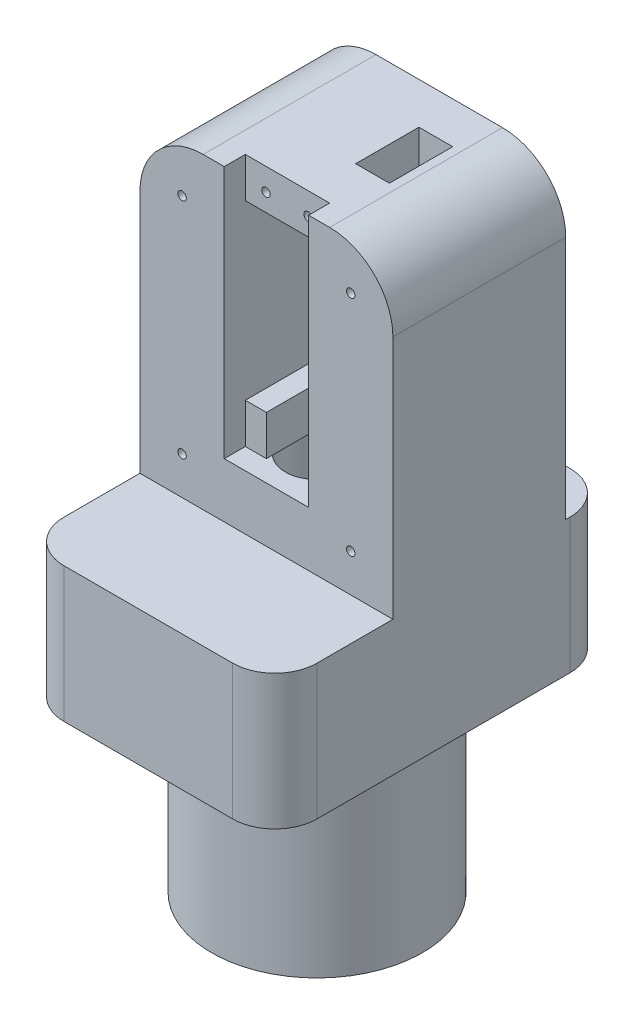
from build123d import *

# Parameters (mm, degrees)
SKETCH1_R                = 25
BOSS_EXTRUDE1_DEPTH      = 45
SKETCH2_W                = 60
SKETCH2_H                = 80
BOSS_EXTRUDE2_DEPTH      = 45
FILLET1_R                = 10
SKETCH3_W                = 60
SKETCH3_H                = 41
BOSS_EXTRUDE3_DEPTH      = 60
SKETCH4_W                = 20
SKETCH4_H                = 41
CUT_EXTRUDE1_DEPTH       = 32
SKETCH5_W                = 20
SKETCH5_H                = 9.5
CUT_EXTRUDE2_DEPTH       = 5
SKETCH7_R                = 15
CUT_EXTRUDE3_DEPTH       = 8
CUT_EXTRUDE4_REACH       = 163.567
SKETCH8_R                = 21
FILLET2_R                = 15
CUT_EXTRUDE5_REACH       = 169.812
SKETCH9_W                = 65
SKETCH9_H                = 65
CUT_EXTRUDE6_REACH       = 163.567
SKETCH10_W               = 65
SKETCH10_H               = 65
SKETCH11_R               = 1
CUT_EXTRUDE7_DEPTH       = 10
SKETCH12_R               = 1
CUT_EXTRUDE8_DEPTH       = 10
CUT_EXTRUDE9_START       = -27
SKETCH13_W               = 10
SKETCH13_H               = 9.5
CUT_EXTRUDE9_DEPTH       = 27
CUT_EXTRUDE10_DEPTH      = 5
CUT_EXTRUDE10_DEPTH_BACK = 3
SKETCH14_W               = 15
SKETCH14_H               = 62.680052408
SKETCH15_R               = 7.5
CUT_EXTRUDE11_DEPTH      = 90
SKETCH16_W               = 24
SKETCH16_H               = 24
CUT_EXTRUDE12_DEPTH      = 10
FILLET3_R                = 3


with BuildPart() as part:
    # Sketch1 → Boss-Extrude1 (new body)
    with BuildSketch(Plane(origin=(0, 0, 0), x_dir=(1, 0, 0), z_dir=(0, 1, 0))):
        with Locations(Location((0, 0, 0), (0, 0, 90))):
            Circle(SKETCH1_R)
    extrude(amount=BOSS_EXTRUDE1_DEPTH)

    # Sketch2 → Boss-Extrude2 (add)
    with BuildSketch(Plane(origin=(0, 45, 0), x_dir=(1, 0, 0), z_dir=(0, 1, 0))):
        Rectangle(SKETCH2_W, SKETCH2_H)
    extrude(amount=BOSS_EXTRUDE2_DEPTH)

    # Fillet1
    fillet1_edges = [part.edges().sort_by_distance(p)[0] for p in [
        (-30, 67.5, -40),
        (-30, 67.5, 40),
        (30, 67.5, 40),
        (30, 67.5, -40),
    ]]
    fillet(fillet1_edges, radius=FILLET1_R)

    # Sketch3 → Boss-Extrude3 (add)
    with BuildSketch(Plane(origin=(0, 90, 0), x_dir=(1, 0, 0), z_dir=(0, 1, 0))):
        with Locations((0, 8.5)):
            Rectangle(SKETCH3_W, SKETCH3_H)
    extrude(amount=BOSS_EXTRUDE3_DEPTH)

    # Sketch4 → Cut-Extrude1 (cut)
    with BuildSketch(Plane.XY.offset(12)):
        with Locations((0, 120)):
            Rectangle(SKETCH4_W, SKETCH4_H)
    extrude(amount=-CUT_EXTRUDE1_DEPTH, mode=Mode.SUBTRACT)

    # Sketch5 → Cut-Extrude2 (cut)
    with BuildSketch(Plane.XY.offset(12)):
        with Locations((0, 94.75)):
            Rectangle(SKETCH5_W, SKETCH5_H)
        with Locations((0, 145.25)):
            Rectangle(SKETCH5_W, SKETCH5_H)
    extrude(amount=-CUT_EXTRUDE2_DEPTH, mode=Mode.SUBTRACT)

    # Sketch7 → Cut-Extrude3 (cut)
    with BuildSketch(Plane(origin=(0, 0, -29), x_dir=(-1, 0, 0), z_dir=(0, 0, -1))):
        with Locations((0.1, 109.5)):
            Circle(SKETCH7_R)
    extrude(amount=-CUT_EXTRUDE3_DEPTH, mode=Mode.SUBTRACT)

    # Sketch8 → Cut-Extrude4 (cut, up to next)
    with BuildSketch(Plane.XY.offset(12), mode=Mode.PRIVATE) as cut_extrude4_sk1:
        with Locations((-0.1, 109.5)):
            Circle(SKETCH8_R)
    cut_extrude4_tool1 = extrude(cut_extrude4_sk1.sketch, amount=CUT_EXTRUDE4_REACH, mode=Mode.PRIVATE) & part.part
    add(cut_extrude4_tool1.solids().sort_by_distance((-0.1, 109.5, 12))[0], mode=Mode.SUBTRACT)

    # Fillet2
    fillet2_edges = [part.edges().sort_by_distance(p)[0] for p in [
        (-30, 150, -8.5),
        (30, 150, -8.5),
    ]]
    fillet(fillet2_edges, radius=FILLET2_R)

    # Sketch9 → Cut-Extrude5 (cut, up to next)
    with BuildSketch(Plane(origin=(0, 0, -29), x_dir=(-1, 0, 0), z_dir=(0, 0, -1)), mode=Mode.PRIVATE) as cut_extrude5_sk1:
        with Locations((0.1, 109.5)):
            Rectangle(SKETCH9_W, SKETCH9_H)
    cut_extrude5_tool1 = extrude(cut_extrude5_sk1.sketch, amount=CUT_EXTRUDE5_REACH, mode=Mode.PRIVATE) & part.part
    add(cut_extrude5_tool1.solids().sort_by_distance((-0.1, 109.5, -29))[0], mode=Mode.SUBTRACT)

    # Sketch10 → Cut-Extrude6 (cut, up to next)
    with BuildSketch(Plane.XY.offset(12), mode=Mode.PRIVATE) as cut_extrude6_sk1:
        with Locations((-0.1, 109.5)):
            Rectangle(SKETCH10_W, SKETCH10_H)
    cut_extrude6_tool1 = extrude(cut_extrude6_sk1.sketch, amount=CUT_EXTRUDE6_REACH, mode=Mode.PRIVATE) & part.part
    add(cut_extrude6_tool1.solids().sort_by_distance((-0.1, 109.5, 12))[0], mode=Mode.SUBTRACT)

    # Sketch11 → Cut-Extrude7 (cut)
    with BuildSketch(Plane.XY.offset(12)):
        with Locations((-20, 86)):
            Circle(SKETCH11_R)
        with Locations((20, 86)):
            Circle(SKETCH11_R)
        with Locations((20, 139)):
            Circle(SKETCH11_R)
        with Locations((-20, 139)):
            Circle(SKETCH11_R)
    extrude(amount=-CUT_EXTRUDE7_DEPTH, mode=Mode.SUBTRACT)

    # Sketch12 → Cut-Extrude8 (cut)
    with BuildSketch(Plane.XY.offset(7)):
        with Locations((4.9, 144.689613301)):
            Circle(SKETCH12_R)
        with Locations((-5.1, 144.689613301)):
            Circle(SKETCH12_R)
    extrude(amount=-CUT_EXTRUDE8_DEPTH, mode=Mode.SUBTRACT)

    # Sketch13 → Cut-Extrude9 (cut)
    with BuildSketch(Plane.XY.offset(7).offset(CUT_EXTRUDE9_START)):
        with Locations((0, 94.75)):
            Rectangle(SKETCH13_W, SKETCH13_H)
    extrude(amount=CUT_EXTRUDE9_DEPTH, mode=Mode.SUBTRACT)

    # Sketch14 → Cut-Extrude10 (cut, two sides: drawn at the far end of the back side and taken through both)
    with BuildSketch(Plane.ZY.offset(-10).offset(-CUT_EXTRUDE10_DEPTH_BACK)):
        with Locations((-11.671219496, 121.340026204)):
            Rectangle(SKETCH14_W, SKETCH14_H)
    extrude(amount=CUT_EXTRUDE10_DEPTH + CUT_EXTRUDE10_DEPTH_BACK, mode=Mode.SUBTRACT)

    # Sketch15 → Cut-Extrude11 (cut)
    with BuildSketch(Plane.XZ):
        with Locations(Location((0, 0, 0), (0, 0, 270))):
            Circle(SKETCH15_R)
    extrude(amount=-CUT_EXTRUDE11_DEPTH, mode=Mode.SUBTRACT)

    # Sketch16 → Cut-Extrude12 (cut)
    with BuildSketch(Plane.XZ):
        Rectangle(SKETCH16_W, SKETCH16_H)
    extrude(amount=-CUT_EXTRUDE12_DEPTH, mode=Mode.SUBTRACT)

    # Fillet3
    fillet3_edges = [part.edges().sort_by_distance(p)[0] for p in [
        (-12, 5, -12),
        (-12, 5, 12),
        (12, 5, 12),
        (12, 5, -12),
    ]]
    fillet(fillet3_edges, radius=FILLET3_R)


solid = part.part
